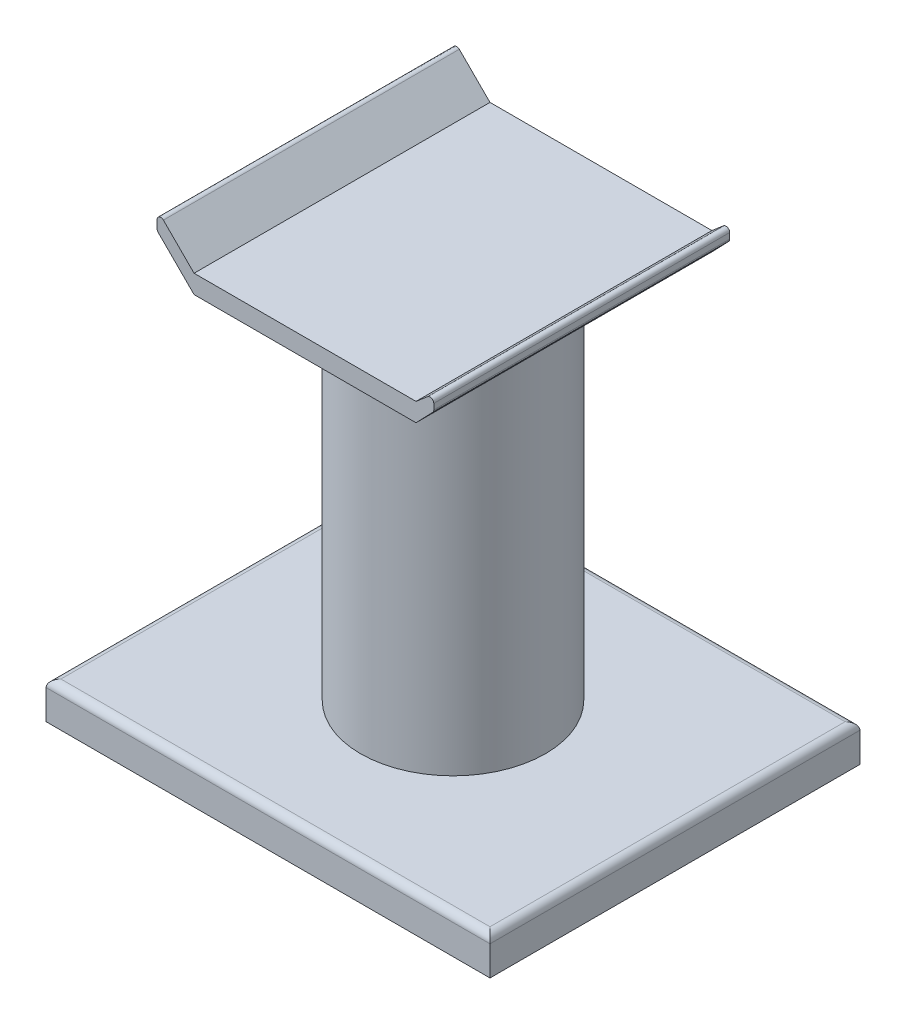
from build123d import *

# Parameters (mm, degrees)
SKETCH_1_W      = 120
SKETCH_1_H      = 100
EXTRUDE_1_DEPTH = 10
SKETCH_2_R      = 25
EXTRUDE_2_DEPTH = 100
SKETCH_3_W      = 60
SKETCH_3_H      = 80
EXTRUDE_3_DEPTH = 5
EXTRUDE_4_DEPTH = 80
EXTRUDE_5_DEPTH = 80
FILLET_2_R      = 1
FILLET_3_R      = 1
FILLET_4_R      = 1
FILLET_5_R      = 1
FILLET_6_R      = 2


with BuildPart() as part:
    # 草图1 → 凸台-拉伸1 (new body)
    with BuildSketch(Plane(origin=(0, 0, 0), x_dir=(1, 0, 0), z_dir=(0, 1, 0))):
        Rectangle(SKETCH_1_W, SKETCH_1_H)
    extrude(amount=EXTRUDE_1_DEPTH)

    # 草图2 → 凸台-拉伸2 (add)
    with BuildSketch(Plane(origin=(0, 10, 0), x_dir=(1, 0, 0), z_dir=(0, 1, 0))):
        with Locations(Location((0, 0, 0), (0, 0, 270))):
            Circle(SKETCH_2_R)
    extrude(amount=EXTRUDE_2_DEPTH)

    # 草图3 → 凸台-拉伸3 (add)
    with BuildSketch(Plane(origin=(0, 110, 0), x_dir=(1, 0, 0), z_dir=(0, 1, 0))):
        Rectangle(SKETCH_3_W, SKETCH_3_H)
    extrude(amount=EXTRUDE_3_DEPTH)

    # 草图5 → 凸台-拉伸4 (add)
    with BuildSketch(Plane.XY.offset(40)):
        Polygon((-40, 125), (-30, 115), (-30, 110), (-40, 120), align=None)
    extrude(amount=-EXTRUDE_4_DEPTH)

    # 草图6 → 凸台-拉伸5 (add)
    with BuildSketch(Plane.XY.offset(40)):
        Polygon((30, 115), (34.805168411, 119.110453023), (34.805168411, 115), (30, 110), align=None)
    extrude(amount=-EXTRUDE_5_DEPTH)

    # 圆角2
    fillet_2_edges = [part.edges().sort_by_distance(p)[0] for p in [
        (-40, 125, 0),
    ]]
    fillet(fillet_2_edges, radius=FILLET_2_R)

    # 圆角3
    fillet_3_edges = [part.edges().sort_by_distance(p)[0] for p in [
        (34.805168411, 119.110453023, 0),
    ]]
    fillet(fillet_3_edges, radius=FILLET_3_R)

    # 圆角4
    fillet_4_edges = [part.edges().sort_by_distance(p)[0] for p in [
        (-40, 120, 0),
    ]]
    fillet(fillet_4_edges, radius=FILLET_4_R)

    # 圆角5
    fillet_5_edges = [part.edges().sort_by_distance(p)[0] for p in [
        (34.805168411, 115, 0),
    ]]
    fillet(fillet_5_edges, radius=FILLET_5_R)

    # 圆角6
    fillet_6_edges = [part.edges().sort_by_distance(p)[0] for p in [
        (-60, 10, 0),
        (0, 10, 50),
        (60, 10, 0),
        (0, 10, -50),
    ]]
    fillet(fillet_6_edges, radius=FILLET_6_R)


solid = part.part
